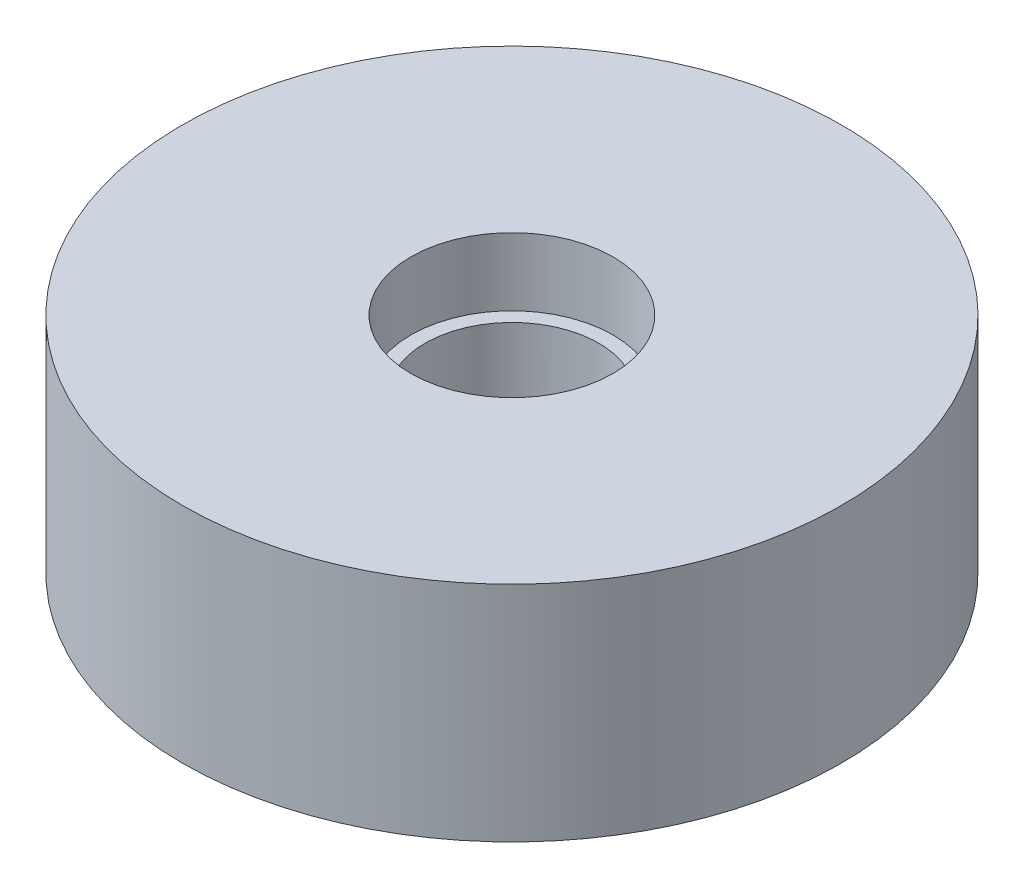
from build123d import *

# Parameters (mm, degrees)
SKETCH1_R           = 35.814
BOSS_EXTRUDE1_DEPTH = 24.257
SKETCH2_R           = 9.4361
CUT_EXTRUDE1_DEPTH  = 57.157699748
SKETCH3_R           = 10.9855
CUT_EXTRUDE2_DEPTH  = 7.3533
CUT_EXTRUDE3_START  = -7.3533
SKETCH4_R           = 10.9855
CUT_EXTRUDE3_DEPTH  = 7.3533


with BuildPart() as part:
    # Sketch1 → Boss-Extrude1 (new body)
    with BuildSketch(Plane(origin=(0, 0, 0), x_dir=(1, 0, 0), z_dir=(0, 1, 0))):
        with Locations(Location((0, 0, 0), (0, 0, 270))):
            Circle(SKETCH1_R)
    extrude(amount=BOSS_EXTRUDE1_DEPTH)

    # Sketch2 → Cut-Extrude1 (cut, through all)
    with BuildSketch(Plane(origin=(0, 24.257, 0), x_dir=(1, 0, 0), z_dir=(0, 1, 0))):
        with Locations(Location((0, 0, 0), (0, 0, 270))):
            Circle(SKETCH2_R)
    extrude(amount=-CUT_EXTRUDE1_DEPTH, mode=Mode.SUBTRACT)

    # Sketch3 → Cut-Extrude2 (cut)
    with BuildSketch(Plane(origin=(0, 24.257, 0), x_dir=(1, 0, 0), z_dir=(0, 1, 0))):
        with Locations(Location((0, 0, 0), (0, 0, 270))):
            Circle(SKETCH3_R)
    extrude(amount=-CUT_EXTRUDE2_DEPTH, mode=Mode.SUBTRACT)

    # Sketch4 → Cut-Extrude3 (cut)
    with BuildSketch(Plane.XZ.offset(CUT_EXTRUDE3_START)):
        with Locations(Location((0, 0, 0), (0, 0, 90))):
            Circle(SKETCH4_R)
    extrude(amount=CUT_EXTRUDE3_DEPTH, mode=Mode.SUBTRACT)


solid = part.part
